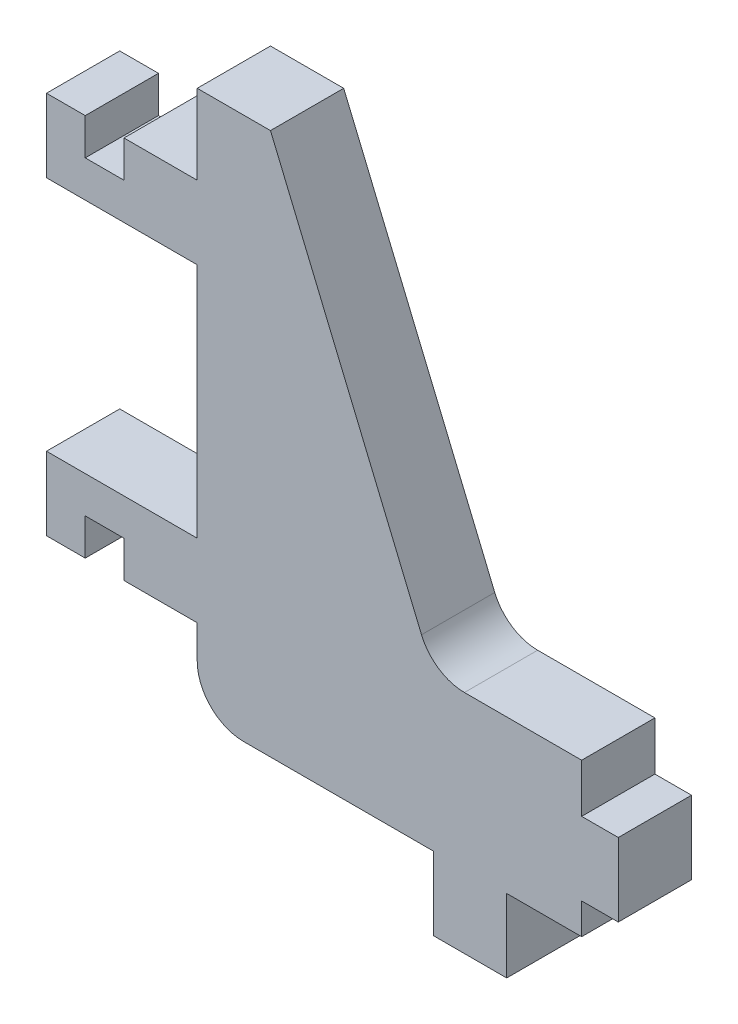
from build123d import *

# Parameters (mm, degrees)
BOSS_EXTRUDE1_DEPTH = 6
FILLET1_R           = 3.81


with BuildPart() as part:
    # Sketch1 → Boss-Extrude1 (new body)
    with BuildSketch(Plane.XY):
        Polygon((-12.35, 31.925), (0, 31.925), (0, 37.925), (-6, 37.925), (-6, 34.925), (-9.175, 34.925), (-9.175, 37.925), (-12.35, 37.925), align=None)
        Polygon((19.3548, 12.525), (31.496, 12.525), (31.496, 8.54), (34.496, 8.54), (34.496, 2.54), (31.496, 2.54), (31.496, 0), (25.3548, 0), (25.3548, -6), (19.3548, -6), (19.3548, 0), (0, 0), (0, 44.45), (6, 44.45), align=None)
        Polygon((-6, 6.525), (0, 6.525), (0, 12.525), (-12.35, 12.525), (-12.35, 6.525), (-9.175, 6.525), (-9.175, 9.525), (-6, 9.525), align=None)
    extrude(amount=BOSS_EXTRUDE1_DEPTH)

    # Fillet1
    fillet1_edges = [part.edges().sort_by_distance(p)[0] for p in [
        (19.3548, 12.525, 3),
        (0, 0, 3),
    ]]
    fillet(fillet1_edges, radius=FILLET1_R)


solid = part.part
